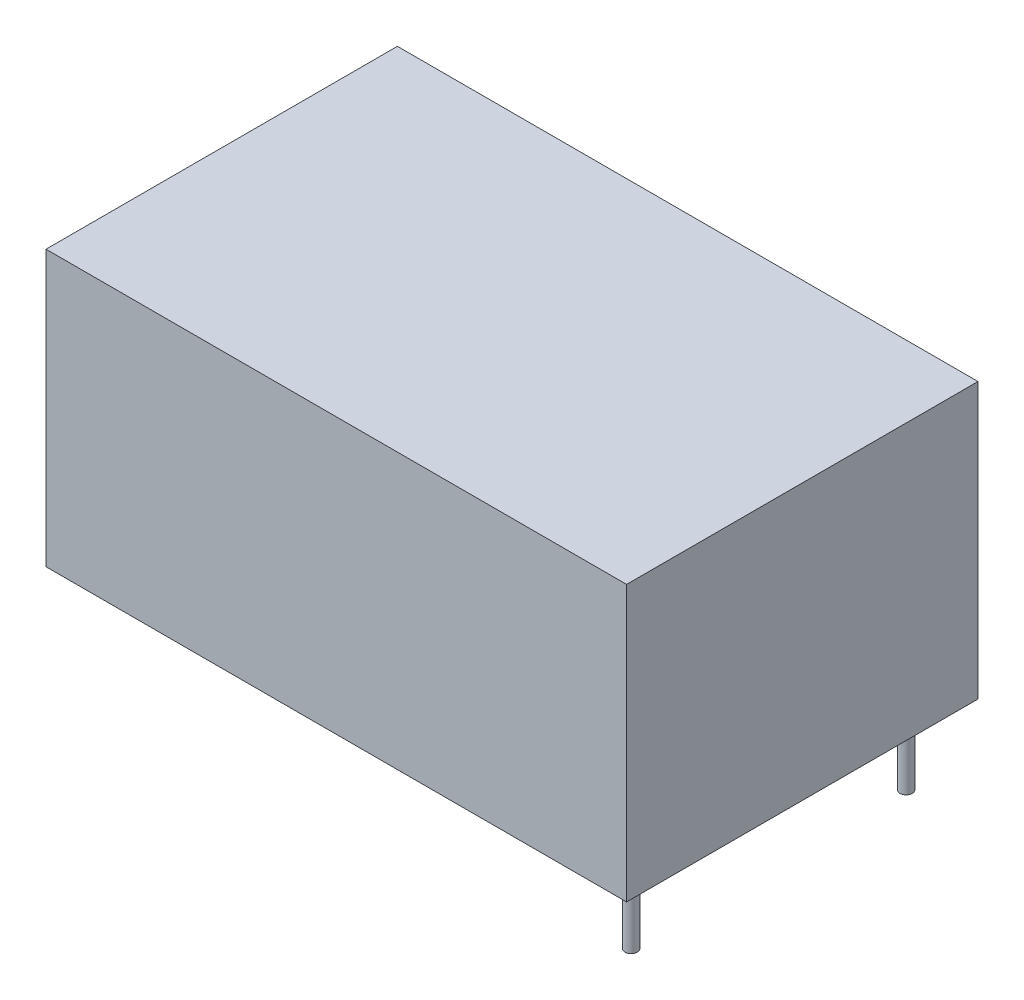
from build123d import *

# Parameters (mm, degrees)
SKETCH1_W           = 38
SKETCH1_H           = 23
BOSS_EXTRUDE1_DEPTH = 18
SKETCH3_R           = 0.4
BOSS_EXTRUDE3_DEPTH = 5
SKETCH4_R           = 0.4
BOSS_EXTRUDE4_DEPTH = 5
SKETCH5_R           = 0.4
BOSS_EXTRUDE5_DEPTH = 5
SKETCH6_R           = 0.4
BOSS_EXTRUDE6_DEPTH = 5


with BuildPart() as part:
    # Sketch1 → Boss-Extrude1 (new body)
    with BuildSketch(Plane.XZ):
        with Locations((0, -0.939824945)):
            Rectangle(SKETCH1_W, SKETCH1_H)
    extrude(amount=-BOSS_EXTRUDE1_DEPTH)

    # Sketch3 → Boss-Extrude3 (add)
    with BuildSketch(Plane.XZ):
        with Locations(Location((16.8, -9.939824945, 0), (0, 0, 270))):
            Circle(SKETCH3_R)
    extrude(amount=BOSS_EXTRUDE3_DEPTH)

    # Sketch4 → Boss-Extrude4 (add)
    with BuildSketch(Plane.XZ):
        with Locations(Location((-16.8, -3.939824945, 0), (0, 0, 270))):
            Circle(SKETCH4_R)
    extrude(amount=BOSS_EXTRUDE4_DEPTH)

    # Sketch5 → Boss-Extrude5 (add)
    with BuildSketch(Plane.XZ):
        with Locations(Location((16.8, 8.060175055, 0), (0, 0, 270))):
            Circle(SKETCH5_R)
    extrude(amount=BOSS_EXTRUDE5_DEPTH)

    # Sketch6 → Boss-Extrude6 (add)
    with BuildSketch(Plane.XZ):
        with Locations(Location((-16.8, 2.060175055, 0), (0, 0, 270))):
            Circle(SKETCH6_R)
    extrude(amount=BOSS_EXTRUDE6_DEPTH)


solid = part.part
